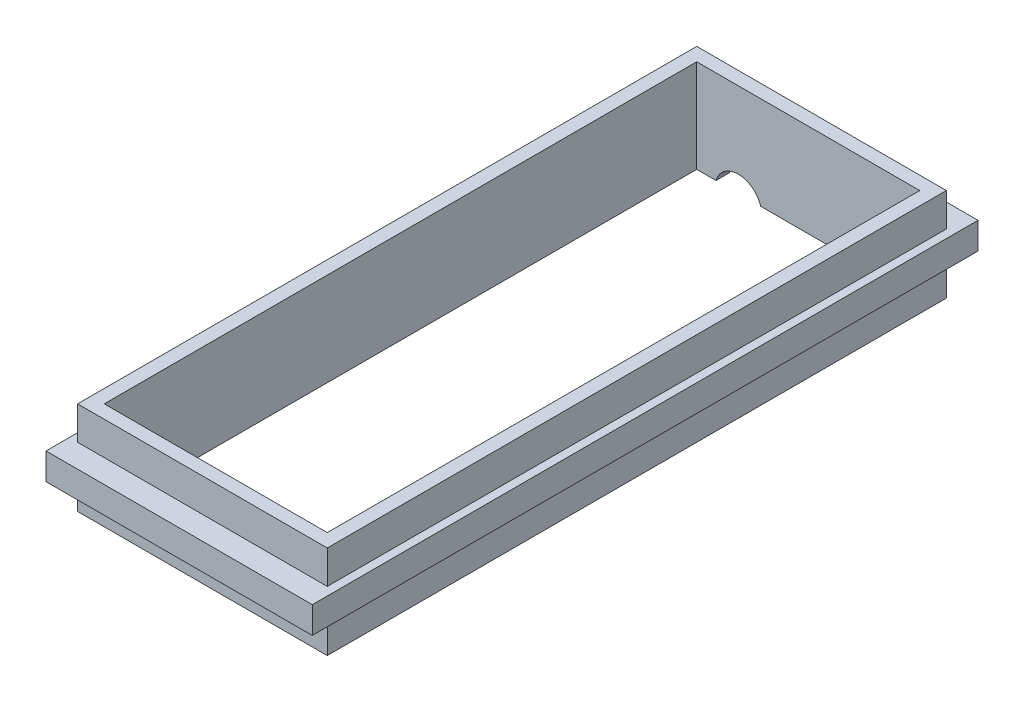
from build123d import *

# Parameters (mm, degrees)
SKETCH1_W           = 37.5
SKETCH1_H           = 93
SKETCH1_W_2         = 33.5
SKETCH1_H_2         = 89
BOSS_EXTRUDE1_DEPTH = 5
SKETCH2_W           = 40
SKETCH2_H           = 100
SKETCH2_W_2         = 33.5
SKETCH2_H_2         = 89
BOSS_EXTRUDE2_DEPTH = 4
SKETCH3_W           = 37.5
SKETCH3_H           = 93
SKETCH3_W_2         = 33.5
SKETCH3_H_2         = 89
BOSS_EXTRUDE3_DEPTH = 5
SKETCH4_R           = 6
CUT_EXTRUDE1_DEPTH  = 5
SKETCH5_R           = 3.5
CUT_EXTRUDE2_DEPTH  = 5


with BuildPart() as part:
    # Sketch1 → Boss-Extrude1 (new body)
    with BuildSketch(Plane(origin=(0, 0, 0), x_dir=(1, 0, 0), z_dir=(0, 1, 0))):
        Rectangle(SKETCH1_W, SKETCH1_H)
        Rectangle(SKETCH1_W_2, SKETCH1_H_2, mode=Mode.SUBTRACT)
    extrude(amount=BOSS_EXTRUDE1_DEPTH)

    # Sketch2 → Boss-Extrude2 (add)
    with BuildSketch(Plane(origin=(0, 5, 0), x_dir=(1, 0, 0), z_dir=(0, 1, 0))):
        Rectangle(SKETCH2_W, SKETCH2_H)
        Rectangle(SKETCH2_W_2, SKETCH2_H_2, mode=Mode.SUBTRACT)
    extrude(amount=BOSS_EXTRUDE2_DEPTH)

    # Sketch3 → Boss-Extrude3 (add)
    with BuildSketch(Plane(origin=(0, 9, 0), x_dir=(1, 0, 0), z_dir=(0, 1, 0))):
        Rectangle(SKETCH3_W, SKETCH3_H)
        Rectangle(SKETCH3_W_2, SKETCH3_H_2, mode=Mode.SUBTRACT)
    extrude(amount=BOSS_EXTRUDE3_DEPTH)

    # Sketch4 → Cut-Extrude1 (cut)
    with BuildSketch(Plane(origin=(0, 0, -46.5), x_dir=(-1, 0, 0), z_dir=(0, 0, -1))):
        with Locations((-11.5, -3)):
            Circle(SKETCH4_R)
    extrude(amount=-CUT_EXTRUDE1_DEPTH, mode=Mode.SUBTRACT)

    # Sketch5 → Cut-Extrude2 (cut)
    with BuildSketch(Plane(origin=(0, 0, -46.5), x_dir=(-1, 0, 0), z_dir=(0, 0, -1))):
        with Locations((10.5, -1)):
            Circle(SKETCH5_R)
    extrude(amount=-CUT_EXTRUDE2_DEPTH, mode=Mode.SUBTRACT)


solid = part.part
